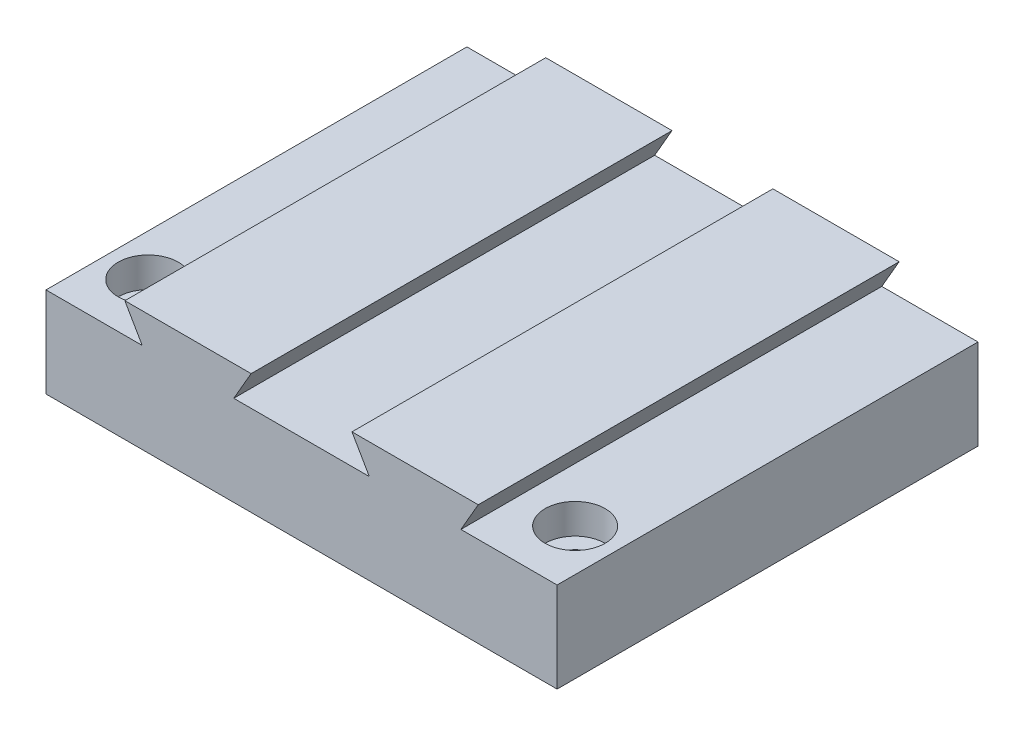
from build123d import *

# Parameters (mm, degrees)
CROQUIS1_W                  = 85
CROQUIS1_H                  = 70
SALIENTE_EXTRUIR1_DEPTH     = 15
CROQUIS3_R                  = 4.15
CORTAR_EXTRUIR1_DEPTH       = 10
CORTAR_EXTRUIR2_DEPTH       = 1
SALIENTE_EXTRUIR4_START     = 10
SALIENTE_EXTRUIR4_DEPTH     = 10
CROQUIS9_W                  = 5.85
CROQUIS9_H                  = 10
SALIENTE_EXTRUIR5_DEPTH     = 9
CROQUIS10_W                 = 20
CROQUIS10_H                 = 10
SALIENTE_EXTRUIR6_DEPTH     = 1
CORTAR_EXTRUIR4_REACH       = 84.335
CROQUIS8_R                  = 1.75
CROQUIS12_W                 = 5.85
CROQUIS12_H                 = 10
CROQUIS12_R                 = 1.75
SALIENTE_EXTRUIR7_DEPTH     = 9
CROQUIS13_W                 = 20
CROQUIS13_H                 = 10
SALIENTE_EXTRUIR8_DEPTH     = 1
CROQUIS14_R                 = 1.75
CORTAR_EXTRUIR5_DEPTH       = 11
SALIENTE_EXTRUIR10_DEPTH    = 70
CROQUIS23_R                 = 5
CORTAR_EXTRUIR9_DEPTH       = 5
CROQUIS22_R                 = 5
CORTAR_EXTRUIR10_DEPTH      = 5
CORTAR_EXTRUIR11_DEPTH      = 59.576872569
CORTAR_EXTRUIR11_DEPTH_BACK = 59.576872569
CROQUIS24_R                 = 2.25
CROQUIS25_W                 = 12
CROQUIS25_H                 = 6
SALIENTE_EXTRUIR11_DEPTH    = 28
REDONDEO1_R                 = 4


with BuildPart() as part:
    # Croquis1 → Saliente-Extruir1 (new body)
    with BuildSketch(Plane(origin=(0, 0, 0), x_dir=(1, 0, 0), z_dir=(0, 1, 0))):
        Rectangle(CROQUIS1_W, CROQUIS1_H)
    extrude(amount=SALIENTE_EXTRUIR1_DEPTH)

    # Croquis3 → Cortar-Extruir1 (cut)
    with BuildSketch(Plane.XZ):
        with Locations(Location((-30.5, 0, 0), (0, 0, 270))):
            Circle(CROQUIS3_R)
        with Locations(Location((30.5, 0, 0), (0, 0, 270))):
            Circle(CROQUIS3_R)
    extrude(amount=-CORTAR_EXTRUIR1_DEPTH, mode=Mode.SUBTRACT)

    # Croquis4 → Cortar-Extruir2 (cut)
    with BuildSketch(Plane(origin=(0, 0, 0), x_dir=(-1, 0, 0), z_dir=(0, -1, 0))):
        Polygon((-3.109375, 6), (-2, 6), (-2, 0), (-2.538461538, 0), (-2.538461538, 5.384615385), (-3.461538462, 5.384615385), align=None)
        Polygon((1.506009615, 6), (2.615384615, 6), (2.615384615, 0), (2.076923077, 0), (2.076923077, 5.384615385), (1.153846154, 5.384615385), align=None)
    extrude(amount=-CORTAR_EXTRUIR2_DEPTH, mode=Mode.SUBTRACT)

    # Croquis5 → Saliente-Extruir4 (add)
    with BuildSketch(Plane.XZ.offset(SALIENTE_EXTRUIR4_START)):
        with BuildLine():
            Line((30.5, -4.15), (30.5, -10))
            ThreePointArc((30.5, -10), (20.5, 0), (30.5, 10))
            Line((30.5, 10), (30.5, 4.15))
            ThreePointArc((30.5, 4.15), (26.35, 0), (30.5, -4.15))
        make_face()
        with BuildLine():
            Line((-30.5, -10), (-30.5, -4.15))
            ThreePointArc((-30.5, -4.15), (-26.35, 0), (-30.5, 4.15))
            Line((-30.5, 4.15), (-30.5, 10))
            ThreePointArc((-30.5, 10), (-20.5, 0), (-30.5, -10))
        make_face()
    extrude(amount=-SALIENTE_EXTRUIR4_DEPTH)

    # Croquis9 → Saliente-Extruir5 (add)
    with BuildSketch(Plane(origin=(30.5, 0, 0), x_dir=(0, 0, -1), z_dir=(1, 0, 0))):
        with Locations((7.075, -5)):
            Rectangle(CROQUIS9_W, CROQUIS9_H)
        with Locations((-7.075, -5)):
            Rectangle(CROQUIS9_W, CROQUIS9_H)
    extrude(amount=-SALIENTE_EXTRUIR5_DEPTH)

    # Croquis10 → Saliente-Extruir6 (add)
    with BuildSketch(Plane.ZY.offset(-21.5)):
        with Locations((0, -5)):
            Rectangle(CROQUIS10_W, CROQUIS10_H)
    extrude(amount=SALIENTE_EXTRUIR6_DEPTH)

    # Croquis8 → Cortar-Extruir4 (cut, up to next)
    with BuildSketch(Plane(origin=(30.5, 0, 0), x_dir=(0, 0, -1), z_dir=(1, 0, 0)), mode=Mode.PRIVATE) as cortar_extruir4_sk1:
        with Locations((7.075, -4.609756337)):
            Circle(CROQUIS8_R)
    cortar_extruir4_tool1 = extrude(cortar_extruir4_sk1.sketch, amount=-CORTAR_EXTRUIR4_REACH, mode=Mode.PRIVATE) & part.part
    # Croquis8 → Cortar-Extruir4 (cut, up to next)
    with BuildSketch(Plane(origin=(30.5, 0, 0), x_dir=(0, 0, -1), z_dir=(1, 0, 0)), mode=Mode.PRIVATE) as cortar_extruir4_sk2:
        with Locations((-7.07, -4.609756337)):
            Circle(CROQUIS8_R)
    cortar_extruir4_tool2 = extrude(cortar_extruir4_sk2.sketch, amount=-CORTAR_EXTRUIR4_REACH, mode=Mode.PRIVATE) & part.part
    add(cortar_extruir4_tool1.solids().sort_by_distance((30.5, -4.609756, -7.075))[0], mode=Mode.SUBTRACT)
    add(cortar_extruir4_tool2.solids().sort_by_distance((30.5, -4.609756, 7.07))[0], mode=Mode.SUBTRACT)

    # Croquis12 → Saliente-Extruir7 (add)
    # profile 1 of 2: a face of its own
    with BuildSketch(Plane.ZY.offset(30.5)):
        with Locations((7.075, -5)):
            Rectangle(CROQUIS12_W, CROQUIS12_H)
        with Locations((7.07, -5)):
            Circle(CROQUIS12_R, mode=Mode.SUBTRACT)
    # profile 2 of 2: a face of its own
    with BuildSketch(Plane.ZY.offset(30.5)):
        with Locations((-7.075, -5)):
            Rectangle(CROQUIS12_W, CROQUIS12_H)
        with Locations((-7.07, -5)):
            Circle(CROQUIS12_R, mode=Mode.SUBTRACT)
    extrude(amount=-SALIENTE_EXTRUIR7_DEPTH)

    # Croquis13 → Saliente-Extruir8 (add)
    with BuildSketch(Plane(origin=(-21.5, 0, 0), x_dir=(0, 0, -1), z_dir=(1, 0, 0))):
        with Locations((0, -5)):
            Rectangle(CROQUIS13_W, CROQUIS13_H)
    extrude(amount=SALIENTE_EXTRUIR8_DEPTH)

    # Croquis14 → Cortar-Extruir5 (cut)
    with BuildSketch(Plane.ZY.offset(30.5)):
        with Locations((7.07, -5)):
            Circle(CROQUIS14_R)
        with Locations((-7.07, -5)):
            Circle(CROQUIS14_R)
    extrude(amount=-CORTAR_EXTRUIR5_DEPTH, mode=Mode.SUBTRACT)

    # Croquis15 → Saliente-Extruir10 (add, through all)
    with BuildSketch(Plane(origin=(0, 0, -35), x_dir=(-1, 0, 0), z_dir=(0, 0, -1))):
        Polygon((-26.5, 15), (-29.386751346, 20), (-8.386751346, 20), (-11.273502692, 15), align=None)
        Polygon((8.386751346, 20), (11.273502692, 15), (26.5, 15), (29.386751346, 20), align=None)
    extrude(amount=-SALIENTE_EXTRUIR10_DEPTH)

    # Croquis23 → Cortar-Extruir9 (cut)
    with BuildSketch(Plane(origin=(0, 15, 0), x_dir=(1, 0, 0), z_dir=(0, 1, 0))):
        with Locations(Location((-35.5, -25, 0), (0, 0, 270))):
            Circle(CROQUIS23_R)
    extrude(amount=-CORTAR_EXTRUIR9_DEPTH, mode=Mode.SUBTRACT)

    # Croquis22 → Cortar-Extruir10 (cut)
    with BuildSketch(Plane(origin=(0, 15, 0), x_dir=(1, 0, 0), z_dir=(0, 1, 0))):
        with Locations(Location((35.5, -25, 0), (0, 0, 270))):
            Circle(CROQUIS22_R)
    extrude(amount=-CORTAR_EXTRUIR10_DEPTH, mode=Mode.SUBTRACT)

    # Croquis24 → Cortar-Extruir11 (cut, two sides: drawn at the far end of the back side and taken through both)
    with BuildSketch(Plane(origin=(0, 10, 0), x_dir=(1, 0, 0), z_dir=(0, 1, 0)).offset(-CORTAR_EXTRUIR11_DEPTH_BACK)):
        with Locations(Location((-35.5, -25, 0), (0, 0, 270))):
            Circle(CROQUIS24_R)
        with Locations(Location((35.5, -25, 0), (0, 0, 270))):
            Circle(CROQUIS24_R)
    extrude(amount=CORTAR_EXTRUIR11_DEPTH + CORTAR_EXTRUIR11_DEPTH_BACK, mode=Mode.SUBTRACT)

    # Croquis25 → Saliente-Extruir11 (add)
    with BuildSketch(Plane.XZ):
        with Locations((-0.1, -23)):
            Rectangle(CROQUIS25_W, CROQUIS25_H)
    extrude(amount=SALIENTE_EXTRUIR11_DEPTH)

    # Redondeo1
    redondeo1_edges = [part.edges().sort_by_distance(p)[0] for p in [
        (5.9, 0, -23),
        (-0.1, 0, -20),
        (-6.1, 0, -23),
        (-0.1, 0, -26),
    ]]
    fillet(redondeo1_edges, radius=REDONDEO1_R)


solid = part.part
